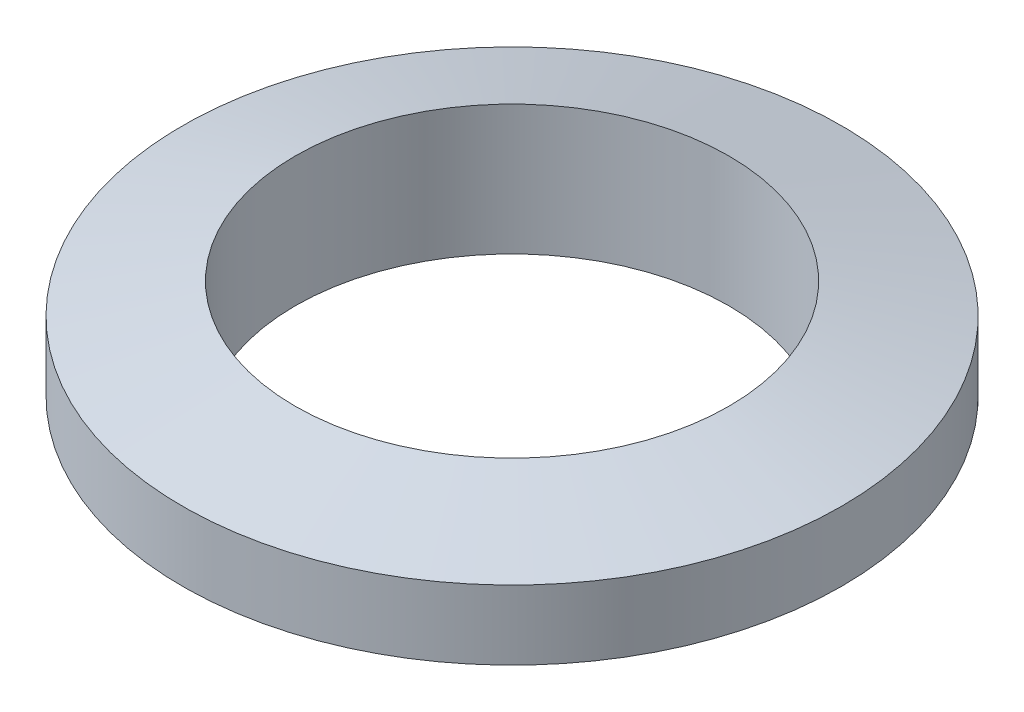
from build123d import *


with BuildPart() as part:
    # Эскиз1 → Повернуть1 (revolve)
    with BuildSketch(Plane.XY, mode=Mode.PRIVATE) as revolve_1_sk:
        Polygon((-12.5, 3.741669751), (-19, 2), (-19, -2), (-12.5, -3.741669751), align=None)
    revolve(revolve_1_sk.sketch.rotate(Axis((0, -1000, 0), (0, 1, 0)), 180), axis=Axis((0, -1000, 0), (0, 1, 0)))


solid = part.part
